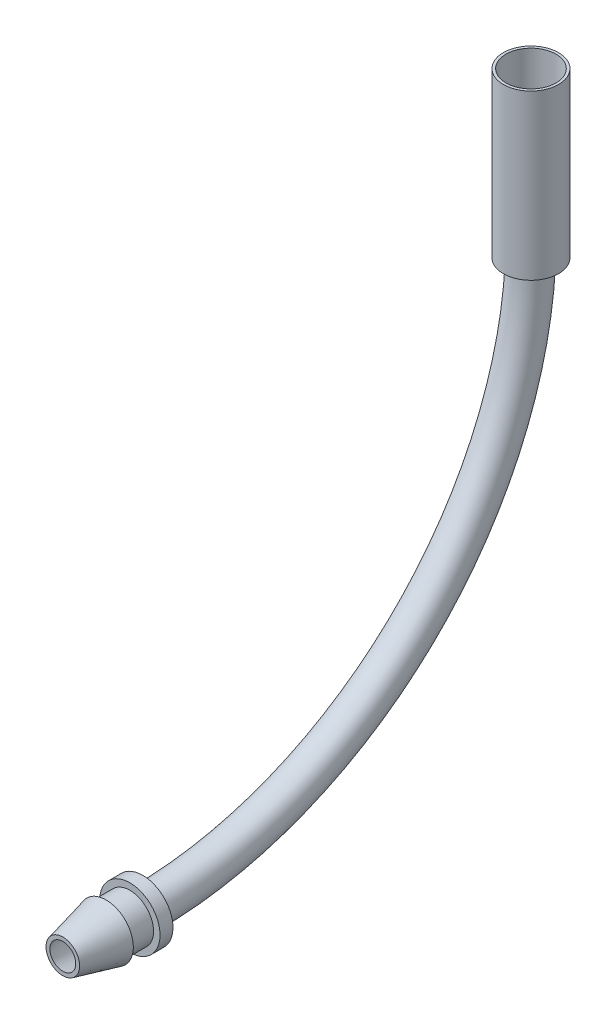
from build123d import *

# Parameters (mm, degrees)
SKETCH2_R                = 2.07
SKETCH2_R_2              = 1.5
SKETCH3_R                = 2.75
SKETCH3_R_2              = 1.5
BOSS_EXTRUDE1_DEPTH      = 4.5
SKETCH4_R                = 3.5
SKETCH4_R_2              = 2.5
BOSS_EXTRUDE2_DEPTH      = 1.5
BOSS_EXTRUDE3_DEPTH      = 1
BOSS_EXTRUDE3_DEPTH_BACK = 2
SKETCH5_R                = 3.2
SKETCH5_R_2              = 1.5
BOSS_EXTRUDE6_DEPTH      = 16
BOSS_EXTRUDE6_DEPTH_BACK = 1
SKETCH10_R               = 3.2
SKETCH10_R_2             = 2.9


with BuildPart() as part:
    # Sweep-Thin1: sweep along a path in Sketch1
    with BuildLine(Plane(origin=(0, 0, 0), x_dir=(0, 0, -1), z_dir=(1, 0, 0))) as sweep_thin1_path:
        ThreePointArc((0, -45), (31.819805153, -31.819805153), (45, 0))
    # Sketch2 → Sweep-Thin1 (sweep)
    with BuildSketch(Plane(origin=(0, -45, 0), x_dir=(-1, 0, 0), z_dir=(0, 0, -1))):
        Circle(SKETCH2_R)
        Circle(SKETCH2_R_2, mode=Mode.SUBTRACT)
    sweep(path=sweep_thin1_path.line)

    # Sketch3 → Boss-Extrude1 (add)
    with BuildSketch(Plane.XY):
        with Locations((0, -45)):
            Circle(SKETCH3_R)
        with Locations(Location((0, -45, 0), (0, 0, 270))):
            Circle(SKETCH3_R_2, mode=Mode.SUBTRACT)
    extrude(amount=BOSS_EXTRUDE1_DEPTH)

    # Sketch4 → Boss-Extrude2 (add)
    with BuildSketch(Plane(origin=(0, -45, 0), x_dir=(-1, 0, 0), z_dir=(0, 0, -1))):
        with Locations(Location((0, 0, 0), (0, 0, 90))):
            Circle(SKETCH4_R)
        Circle(SKETCH4_R_2, mode=Mode.SUBTRACT)
    extrude(amount=-BOSS_EXTRUDE2_DEPTH)

    # Sketch8 → Revolve1 (revolve)
    with BuildSketch(Plane(origin=(0, 0, 0), x_dir=(0, 0, -1), z_dir=(1, 0, 0)), mode=Mode.PRIVATE) as revolve1_sk:
        Polygon((-4.25711996, -42.351079614), (-4.25711996, -41.838122818), (-9.271481687, -43.053091763), (-9.271481687, -43.5), align=None)
    revolve(revolve1_sk.sketch.rotate(Axis((0, -45, 4.5), (0, 0, 1)), 90), axis=Axis((0, -45, 4.5), (0, 0, 1)))


with BuildPart() as body_2:
    # Sketch5 → Boss-Extrude3 (new, two sides: drawn at the far end of the back side and taken through both)
    with BuildSketch(Plane(origin=(0, 0, 0), x_dir=(1, 0, 0), z_dir=(0, 1, 0)).offset(-BOSS_EXTRUDE3_DEPTH_BACK)):
        with Locations(Location((0, 45, 0), (0, 0, 270))):
            Circle(SKETCH5_R)
        with Locations(Location((0, 45, 0), (0, 0, 270))):
            Circle(SKETCH5_R_2, mode=Mode.SUBTRACT)
    extrude(amount=BOSS_EXTRUDE3_DEPTH + BOSS_EXTRUDE3_DEPTH_BACK)

    # Sketch10 → Boss-Extrude6 (add, two sides: drawn at the far end of the back side and taken through both)
    with BuildSketch(Plane(origin=(0, 1, 0), x_dir=(1, 0, 0), z_dir=(0, 1, 0)).offset(-BOSS_EXTRUDE6_DEPTH_BACK)):
        with Locations(Location((0, 45, 0), (0, 0, 270))):
            Circle(SKETCH10_R)
        with Locations(Location((0, 45, 0), (0, 0, 270))):
            Circle(SKETCH10_R_2, mode=Mode.SUBTRACT)
    extrude(amount=BOSS_EXTRUDE6_DEPTH + BOSS_EXTRUDE6_DEPTH_BACK)


solid = Compound([part.part, body_2.part])
